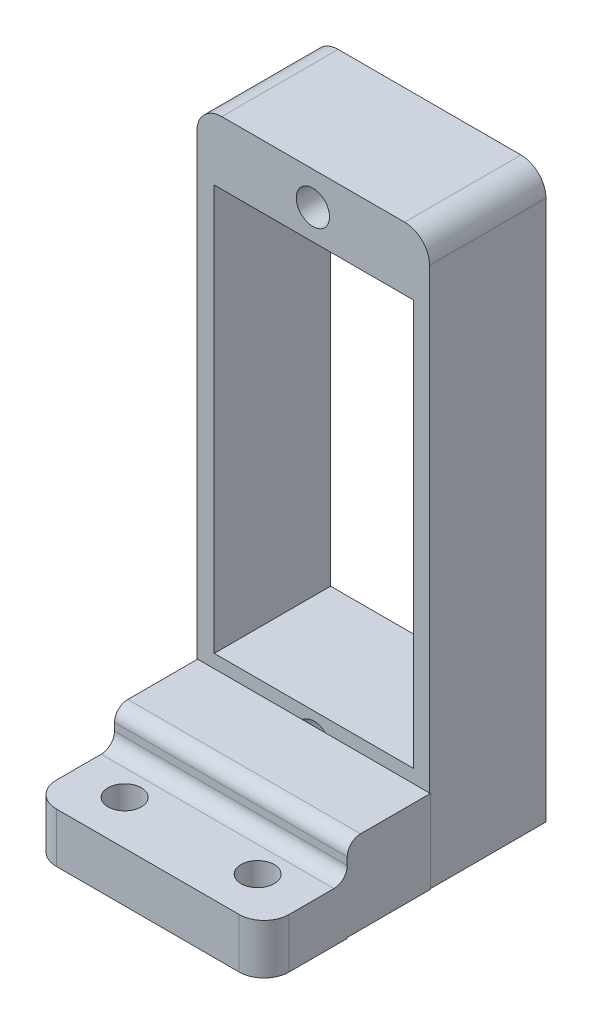
from build123d import *

# Parameters (mm, degrees)
SKETCH1_W           = 14
SKETCH1_H           = 34
BOSS_EXTRUDE1_DEPTH = 7
SKETCH2_R           = 1
SKETCH2_W           = 12
SKETCH2_H           = 24.4
CUT_EXTRUDE1_DEPTH  = 555.564285541
SKETCH3_W           = 14
SKETCH3_H           = 5
BOSS_EXTRUDE2_DEPTH = 5
SKETCH4_W           = 14
SKETCH4_H           = 3
BOSS_EXTRUDE3_DEPTH = 5
FILLET1_R           = 1.5
FILLET2_R           = 0.8
SKETCH5_R           = 1
CUT_EXTRUDE2_DEPTH  = 7
SKETCH6_R           = 1
CUT_EXTRUDE3_DEPTH  = 252.483055086


with BuildPart() as part:
    # Sketch1 → Boss-Extrude1 (new body)
    with BuildSketch(Plane.XY.offset(25)):
        with Locations((238.952994655, 479.990614818)):
            Rectangle(SKETCH1_W, SKETCH1_H)
    extrude(amount=BOSS_EXTRUDE1_DEPTH)

    # Sketch2 → Cut-Extrude1 (cut, through all)
    with BuildSketch(Plane.XY.offset(32)):
        with Locations((238.935079192, 495.003072258)):
            Circle(SKETCH2_R)
        with Locations((239, 481.000012207)):
            Rectangle(SKETCH2_W, SKETCH2_H)
    extrude(amount=-CUT_EXTRUDE1_DEPTH, mode=Mode.SUBTRACT)

    # Sketch3 → Boss-Extrude2 (add)
    with BuildSketch(Plane.XY.offset(32)):
        with Locations((239, 465.5)):
            Rectangle(SKETCH3_W, SKETCH3_H)
    extrude(amount=BOSS_EXTRUDE2_DEPTH)

    # Sketch4 → Boss-Extrude3 (add)
    with BuildSketch(Plane.XY.offset(37)):
        with Locations((239, 464.446662177)):
            Rectangle(SKETCH4_W, SKETCH4_H)
    extrude(amount=BOSS_EXTRUDE3_DEPTH)

    # Fillet1
    fillet1_edges = [part.edges().sort_by_distance(p)[0] for p in [
        (232, 464.446662177, 42),
        (246, 464.446662177, 42),
        (231.952994655, 496.990614818, 28.5),
        (245.952994655, 496.990614818, 28.5),
    ]]
    fillet(fillet1_edges, radius=FILLET1_R)

    # Fillet2
    fillet2_edges = [part.edges().sort_by_distance(p)[0] for p in [
        (239, 468, 37),
        (239, 465.946662177, 37),
    ]]
    fillet(fillet2_edges, radius=FILLET2_R)

    # Sketch5 → Cut-Extrude2 (cut)
    with BuildSketch(Plane(origin=(0, 0, 25), x_dir=(-1, 0, 0), z_dir=(0, 0, -1))):
        with Locations((-238.99635452, 467.272454622)):
            Circle(SKETCH5_R)
    extrude(amount=-CUT_EXTRUDE2_DEPTH, mode=Mode.SUBTRACT)

    # Sketch6 → Cut-Extrude3 (cut, through all)
    with BuildSketch(Plane(origin=(0, 465.946662177, 0), x_dir=(1, 0, 0), z_dir=(0, 1, 0))):
        with Locations(Location((234.951502539, -39.341225233, 0), (0, 0, 270))):
            Circle(SKETCH6_R)
        with Locations(Location((242.951502539, -39.341225233, 0), (0, 0, 270))):
            Circle(SKETCH6_R)
    extrude(amount=-CUT_EXTRUDE3_DEPTH, mode=Mode.SUBTRACT)


solid = part.part
